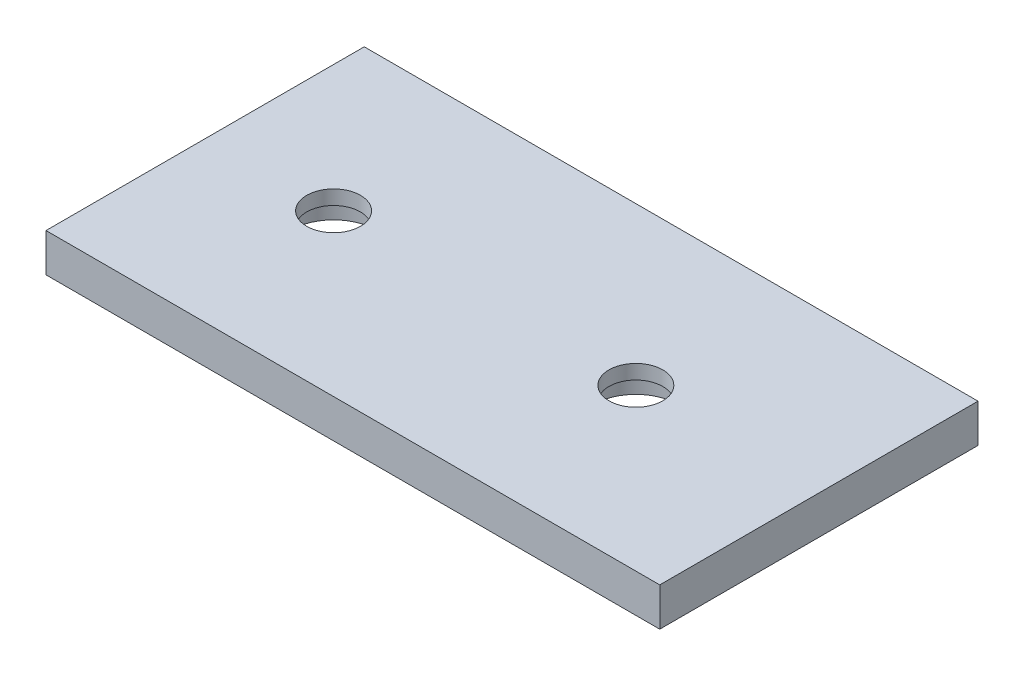
from build123d import *

# Parameters (mm, degrees)
SKETCH1_W           = 203.047872021
SKETCH1_H           = 105.284081788
SKETCH1_R           = 8.89
BOSS_EXTRUDE1_DEPTH = 12.7
SKETCH2_R           = 14.2875
CUT_EXTRUDE1_DEPTH  = 7.9375


with BuildPart() as part:
    # Sketch1 → Boss-Extrude1 (new body)
    with BuildSketch(Plane(origin=(0, 0, 0), x_dir=(1, 0, 0), z_dir=(0, 1, 0))):
        with Locations((-40.397463616, -0.578483966)):
            Rectangle(SKETCH1_W, SKETCH1_H)
        with Locations(Location((-100, 0, 0), (0, 0, 270))):
            Circle(SKETCH1_R, mode=Mode.SUBTRACT)
        with Locations(Location((0, 0, 0), (0, 0, 270))):
            Circle(SKETCH1_R, mode=Mode.SUBTRACT)
    extrude(amount=BOSS_EXTRUDE1_DEPTH)

    # Sketch2 → Cut-Extrude1 (cut)
    with BuildSketch(Plane(origin=(0, 0, 0), x_dir=(1, 0, 0), z_dir=(0, 1, 0))):
        with Locations(Location((-100, 0, 0), (0, 0, 270))):
            Circle(SKETCH2_R)
        with Locations(Location((0, 0, 0), (0, 0, 270))):
            Circle(SKETCH2_R)
    extrude(amount=CUT_EXTRUDE1_DEPTH, mode=Mode.SUBTRACT)


solid = part.part
